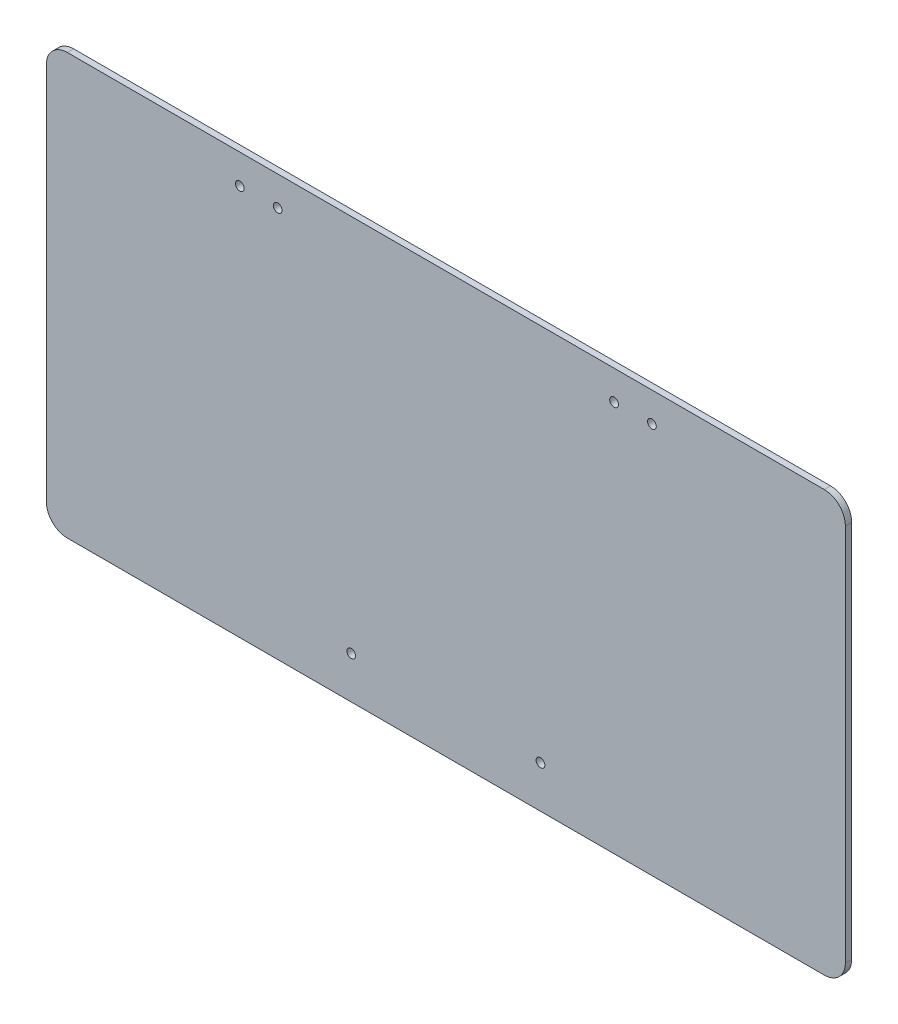
from build123d import *

# Parameters (mm, degrees)
SKETCH_1_W          = 380
SKETCH_1_H          = 200
EXTRUDE_1_DEPTH     = 3
SKETCH_2_R          = 2.075
CUT_EXTRUDE_1_DEPTH = 215.730063102
FILLET_1_R          = 10
SKETCH_3_R          = 2.075
CUT_EXTRUDE_2_DEPTH = 5


with BuildPart() as part:
    # 草图1 → 凸台-拉伸1 (new body)
    with BuildSketch(Plane.XY):
        Rectangle(SKETCH_1_W, SKETCH_1_H)
    extrude(amount=EXTRUDE_1_DEPTH)

    # 草图2 → 切除-拉伸1 (cut, through all)
    with BuildSketch(Plane.XY.offset(3)):
        with Locations((-98, 86)):
            Circle(SKETCH_2_R)
        with Locations((-80, 86)):
            Circle(SKETCH_2_R)
        with Locations(Location((80, 86, 0), (0, 0, 180))):
            Circle(SKETCH_2_R)
        with Locations(Location((98, 86, 0), (0, 0, 180))):
            Circle(SKETCH_2_R)
    extrude(amount=-CUT_EXTRUDE_1_DEPTH, mode=Mode.SUBTRACT)

    # 圆角1
    fillet_1_edges = [part.edges().sort_by_distance(p)[0] for p in [
        (190, -100, 1.5),
        (-190, -100, 1.5),
        (-190, 100, 1.5),
        (190, 100, 1.5),
    ]]
    fillet(fillet_1_edges, radius=FILLET_1_R)

    # 草图3 → 切除-拉伸2 (cut)
    with BuildSketch(Plane.XY.offset(3)):
        with Locations((-45, -80)):
            Circle(SKETCH_3_R)
        with Locations((45, -80)):
            Circle(SKETCH_3_R)
    extrude(amount=-CUT_EXTRUDE_2_DEPTH, mode=Mode.SUBTRACT)


solid = part.part
